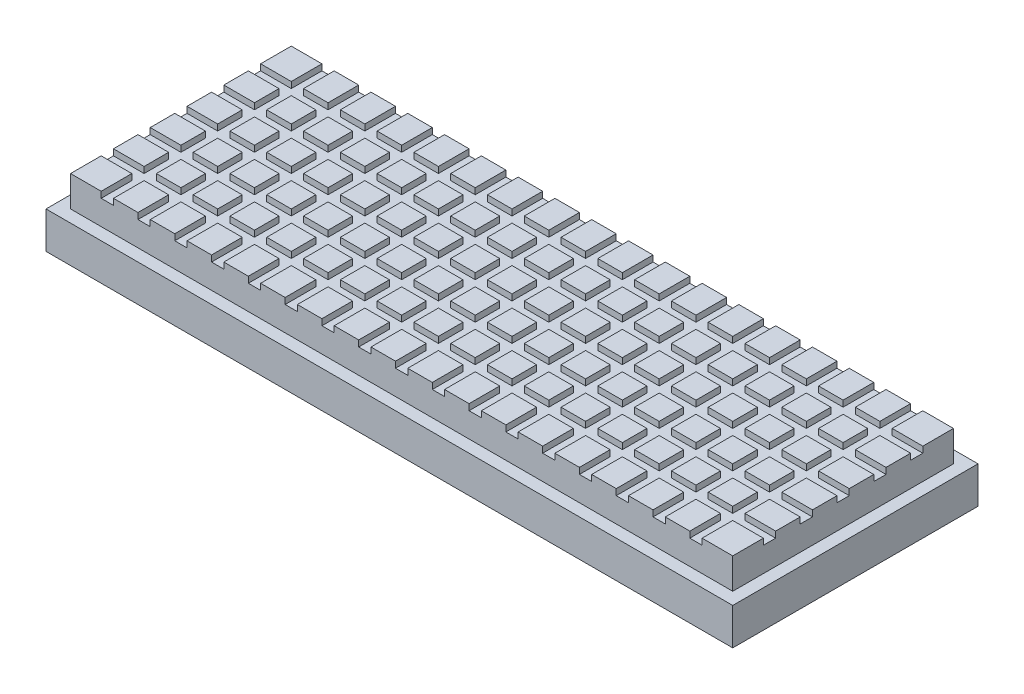
from build123d import *

# Parameters (mm, degrees)
SKETCH1_W           = 355.6
SKETCH1_H           = 127
BOSS_EXTRUDE1_DEPTH = 19.05
SKETCH2_W           = 342.9
SKETCH2_H           = 114.3
BOSS_EXTRUDE2_DEPTH = 15.875
SKETCH3_W           = 6.35
SKETCH3_H           = 114.3
CUT_EXTRUDE1_DEPTH  = 3.175
LPATTERN1_COUNT     = 9
LPATTERN1_PITCH     = 19.05
LPATTERN1_COL_COUNT = 9
LPATTERN1_COL_PITCH = 19.05
SKETCH4_W           = 342.9
SKETCH4_H           = 6.35
CUT_EXTRUDE2_DEPTH  = 3.175
LPATTERN2_COUNT     = 3
LPATTERN2_PITCH     = 19.05
LPATTERN2_COL_COUNT = 3
LPATTERN2_COL_PITCH = 19.05


with BuildPart() as part:
    # Sketch1 → Boss-Extrude1 (new body)
    with BuildSketch(Plane(origin=(0, 0, 0), x_dir=(1, 0, 0), z_dir=(0, 1, 0))):
        Rectangle(SKETCH1_W, SKETCH1_H)
    extrude(amount=BOSS_EXTRUDE1_DEPTH)

    # Sketch2 → Boss-Extrude2 (add)
    with BuildSketch(Plane(origin=(0, 19.05, 0), x_dir=(1, 0, 0), z_dir=(0, 1, 0))):
        Rectangle(SKETCH2_W, SKETCH2_H)
    extrude(amount=BOSS_EXTRUDE2_DEPTH)

    # Sketch3 → Cut-Extrude1 (cut)
    with BuildSketch(Plane(origin=(0, 34.925, 0), x_dir=(1, 0, 0), z_dir=(0, 1, 0))):
        Rectangle(SKETCH3_W, SKETCH3_H)
    cut_extrude1 = extrude(amount=-CUT_EXTRUDE1_DEPTH, mode=Mode.SUBTRACT)

    # LPattern1: Cut-Extrude1 ×9
    with Locations(*[(-i * LPATTERN1_PITCH, 0, 0) for i in range(1, LPATTERN1_COUNT)]):
        add(cut_extrude1, mode=Mode.SUBTRACT)

    # LPattern1 col: Cut-Extrude1 ×9
    with Locations(*[(i * LPATTERN1_COL_PITCH, 0, 0) for i in range(1, LPATTERN1_COL_COUNT)]):
        add(cut_extrude1, mode=Mode.SUBTRACT)

    # Sketch4 → Cut-Extrude2 (cut)
    with BuildSketch(Plane(origin=(0, 34.925, 0), x_dir=(1, 0, 0), z_dir=(0, 1, 0))):
        Rectangle(SKETCH4_W, SKETCH4_H)
    cut_extrude2 = extrude(amount=-CUT_EXTRUDE2_DEPTH, mode=Mode.SUBTRACT)

    # LPattern2: Cut-Extrude2 ×3
    with Locations(*[(0, 0, -i * LPATTERN2_PITCH) for i in range(1, LPATTERN2_COUNT)]):
        add(cut_extrude2, mode=Mode.SUBTRACT)

    # LPattern2 col: Cut-Extrude2 ×3
    with Locations(*[(0, 0, i * LPATTERN2_COL_PITCH) for i in range(1, LPATTERN2_COL_COUNT)]):
        add(cut_extrude2, mode=Mode.SUBTRACT)


solid = part.part
